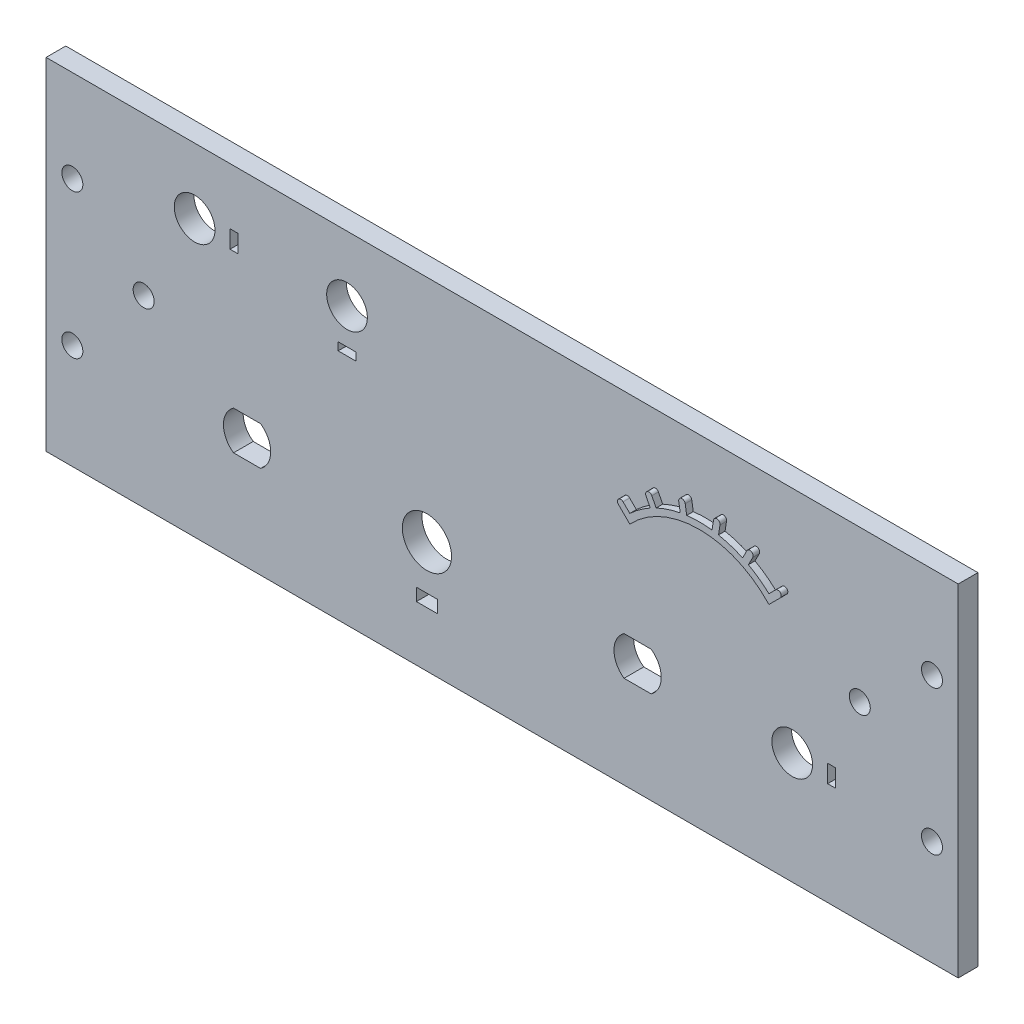
from build123d import *

# Parameters (mm, degrees)
SKETCH1_W           = 139
SKETCH1_H           = 52
SKETCH1_R           = 3.1
SKETCH1_R_2         = 1.6
SKETCH1_R_3         = 3.75
SKETCH1_W_2         = 3.2
SKETCH1_H_2         = 1.9
SKETCH1_W_3         = 1.2
SKETCH1_H_3         = 2.7
SKETCH1_W_4         = 2.7
SKETCH1_H_4         = 1.2
BOSS_EXTRUDE1_DEPTH = 3
BOSS_EXTRUDE2_DEPTH = 1


with BuildPart() as part:
    # Sketch1 → Boss-Extrude1 (new body)
    with BuildSketch(Plane.XY):
        with Locations((69.5, 26)):
            Rectangle(SKETCH1_W, SKETCH1_H)
        with Locations((22.634375474, 42.047579972)):
            Circle(SKETCH1_R, mode=Mode.SUBTRACT)
        with Locations((4, 38)):
            Circle(SKETCH1_R_2, mode=Mode.SUBTRACT)
        with Locations((135, 38)):
            Circle(SKETCH1_R_2, mode=Mode.SUBTRACT)
        with Locations((135, 16)):
            Circle(SKETCH1_R_2, mode=Mode.SUBTRACT)
        with Locations((4, 16)):
            Circle(SKETCH1_R_2, mode=Mode.SUBTRACT)
        with Locations((14.866068747, 28)):
            Circle(SKETCH1_R_2, mode=Mode.SUBTRACT)
        with Locations((124, 28.922858178)):
            Circle(SKETCH1_R_2, mode=Mode.SUBTRACT)
        with Locations((58.031961536, 17.043942087)):
            Circle(SKETCH1_R_3, mode=Mode.SUBTRACT)
        with Locations((45.857489394, 42.12137557)):
            Circle(SKETCH1_R, mode=Mode.SUBTRACT)
        with Locations((113.702920713, 17.043942087)):
            Circle(SKETCH1_R, mode=Mode.SUBTRACT)
        with Locations((58.031961536, 9.343942087)):
            Rectangle(SKETCH1_W_2, SKETCH1_H_2, mode=Mode.SUBTRACT)
        with Locations((28.634375474, 42.047579972)):
            Rectangle(SKETCH1_W_3, SKETCH1_H_3, mode=Mode.SUBTRACT)
        with BuildLine():
            Line((88.076124719, 14.093942087), (92.202866775, 14.093942087))
            ThreePointArc((92.202866775, 14.093942087), (93.739495747, 17.043942087), (92.202866775, 19.993942087))
            Line((92.202866775, 19.993942087), (88.076124719, 19.993942087))
            ThreePointArc((88.076124719, 19.993942087), (86.539495747, 17.043942087), (88.076124719, 14.093942087))
        make_face(mode=Mode.SUBTRACT)
        with Locations((45.857489394, 36.12137557)):
            Rectangle(SKETCH1_W_4, SKETCH1_H_4, mode=Mode.SUBTRACT)
        with BuildLine():
            Line((28.564994968, 14.093942087), (32.691737024, 14.093942087))
            ThreePointArc((32.691737024, 14.093942087), (34.228365996, 17.043942087), (32.691737024, 19.993942087))
            Line((32.691737024, 19.993942087), (28.564994968, 19.993942087))
            ThreePointArc((28.564994968, 19.993942087), (27.028365996, 17.043942087), (28.564994968, 14.093942087))
        make_face(mode=Mode.SUBTRACT)
        with Locations((119.702920713, 17.043942087)):
            Rectangle(SKETCH1_W_3, SKETCH1_H_3, mode=Mode.SUBTRACT)
    extrude(amount=BOSS_EXTRUDE1_DEPTH)

    # Sketch2 → Boss-Extrude2 (add)
    with BuildSketch(Plane.XY.offset(3)):
        with BuildLine():
            Line((111.153182821, 37.289690551), (112.17756564, 38.314073369))
            ThreePointArc((112.17756564, 38.314073369), (112.884672421, 38.314073369), (112.884672421, 37.606966588))
            Line((112.884672421, 37.606966588), (111.152789219, 35.875083385))
            ThreePointArc((111.152789219, 35.875083385), (100.552285062, 40.48168601), (89.951780905, 35.875083385))
            Line((89.951780905, 35.875083385), (88.219897703, 37.606966588))
            ThreePointArc((88.219897703, 37.606966588), (88.219897703, 38.314073369), (88.927004484, 38.314073369))
            Line((88.927004484, 38.314073369), (89.951387302, 37.289690551))
            ThreePointArc((89.951387302, 37.289690551), (91.441613651, 38.521449423), (93.073591221, 39.558104478))
            Line((93.073591221, 39.558104478), (92.415896966, 40.848902132))
            ThreePointArc((92.415896966, 40.848902132), (92.634404978, 41.521400644), (93.30690349, 41.302892632))
            Line((93.30690349, 41.302892632), (93.964597745, 40.012094978))
            ThreePointArc((93.964597745, 40.012094978), (95.762521649, 40.723062012), (97.63496858, 41.204670755))
            Line((97.63496858, 41.204670755), (97.408342585, 42.635530977))
            ThreePointArc((97.408342585, 42.635530977), (97.823969523, 43.20759238), (98.396030925, 42.791965442))
            Line((98.396030925, 42.791965442), (98.622656921, 41.36110522))
            ThreePointArc((98.622656921, 41.36110522), (100.552285062, 41.48168601), (102.481913203, 41.36110522))
            Line((102.481913203, 41.36110522), (102.708539199, 42.791965442))
            ThreePointArc((102.708539199, 42.791965442), (103.280600601, 43.20759238), (103.696227539, 42.635530977))
            Line((103.696227539, 42.635530977), (103.469601544, 41.204670755))
            ThreePointArc((103.469601544, 41.204670755), (105.342048475, 40.723062012), (107.139972379, 40.012094978))
            Line((107.139972379, 40.012094978), (107.797666634, 41.302892632))
            ThreePointArc((107.797666634, 41.302892632), (108.470165146, 41.521400644), (108.688673158, 40.848902132))
            Line((108.688673158, 40.848902132), (108.030978903, 39.558104478))
            ThreePointArc((108.030978903, 39.558104478), (109.662956473, 38.521449423), (111.153182821, 37.289690551))
        make_face()
    extrude(amount=BOSS_EXTRUDE2_DEPTH)


solid = part.part
